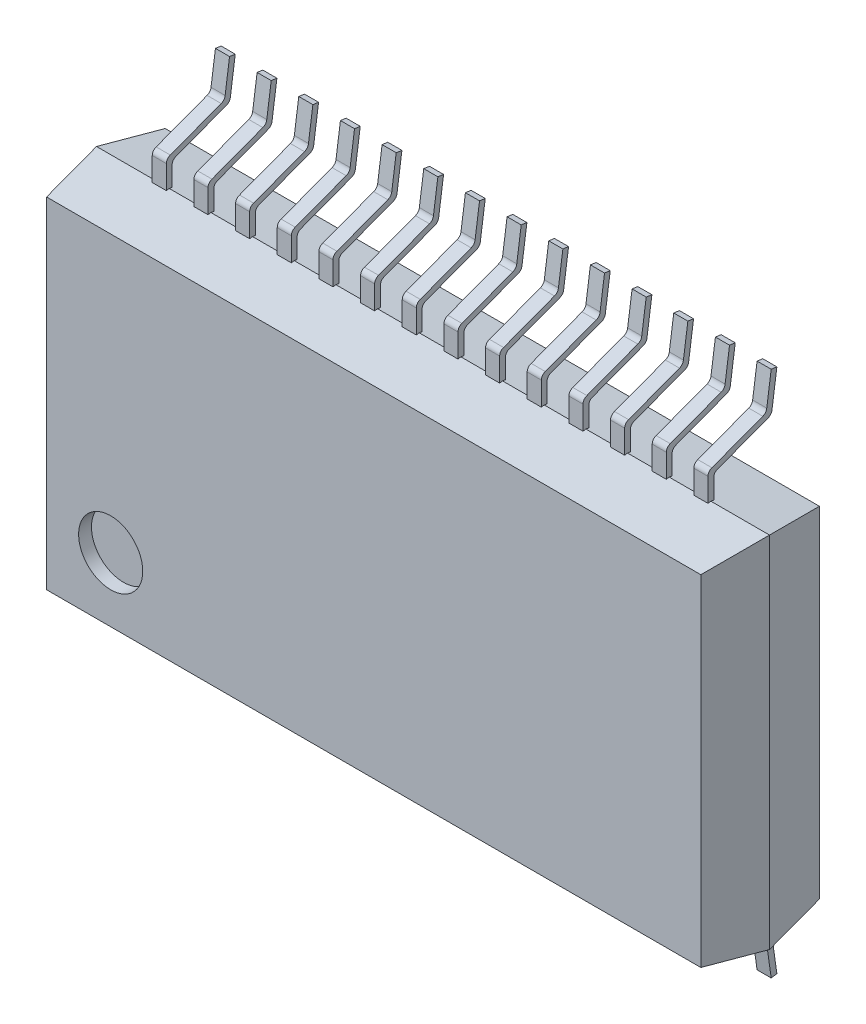
from build123d import *

# Parameters (mm, degrees)
ESBO_O1_W                  = 10.5
ESBO_O1_H                  = 5.6
EXTRUS_O1_DEPTH            = 0.925
EXTRUS_O1_TAPER            = 9
ESBO_O2_W                  = 10.5
ESBO_O2_H                  = 5.6
EXTRUS_O2_DEPTH            = 0.925
EXTRUS_O2_DRAFT            = -9
EXTRUS_O3_DEPTH            = 0.22
EXTRUS_O3_2_DEPTH          = 0.22
PADR_O_LINEAR2_COUNT       = 14
PADR_O_LINEAR2_PITCH       = 0.65
CORTE_EXTRUS_O1_DEPTH      = 0.2
CORTE_EXTRUS_O1_DEPTH_BACK = 0.2
CORTE_EXTRUS_O1_START      = 0.925
ESBO_O7_R                  = 0.5


with BuildPart() as part:
    # Esboço1 → Extrusão1 (new body)
    with BuildSketch(Plane.XY):
        with Locations((4.335, 2.8)):
            Rectangle(ESBO_O1_W, ESBO_O1_H)
    extrude(amount=EXTRUS_O1_DEPTH, taper=EXTRUS_O1_TAPER)

    # Esboço7 → Corte-extrusão1 (cut, two sides: drawn at the far end of the back side and taken through both)
    with BuildSketch(Plane.XY.offset(CORTE_EXTRUS_O1_START - CORTE_EXTRUS_O1_DEPTH_BACK)):
        with Locations((0.231505607, 1.146505607)):
            Circle(ESBO_O7_R)
    extrude(amount=CORTE_EXTRUS_O1_DEPTH + CORTE_EXTRUS_O1_DEPTH_BACK, mode=Mode.SUBTRACT)


with BuildPart() as body_2:
    # Esboço2 → Extrusão2 (with draft: the straight prism first)
    with BuildSketch(Plane.XY):
        with Locations((4.335, 2.8)):
            Rectangle(ESBO_O2_W, ESBO_O2_H)
    extrude(amount=-EXTRUS_O2_DEPTH)
    # Extrusão2: the draft: its side faces are tilted about the plane it starts from
    extrus_o2_sides = [body_2.faces().sort_by_distance(p)[0] for p in [
        (-0.915, 2.8, -0.4625),
        (4.335, 0, -0.4625),
        (9.585, 2.8, -0.4625),
        (4.335, 5.6, -0.4625),
    ]]
    draft(extrus_o2_sides, Plane.XY, EXTRUS_O2_DRAFT)


with BuildPart() as body_3:
    # Esboço3 → Extrusão3 (new body)
    with BuildSketch(Plane(origin=(0, 0, 0), x_dir=(0, 0, -1), z_dir=(1, 0, 0))):
        with BuildLine():
            Line((1.03, 6.9), (0.940875874, 6.912525579))
            Line((0.940875874, 6.912525579), (0.871853672, 6.421407093))
            ThreePointArc((0.871853672, 6.421407093), (0.85269388, 6.372952019), (0.810404985, 6.342511238))
            Line((0.810404985, 6.342511238), (0.016401135, 6.04365025))
            ThreePointArc((0.016401135, 6.04365025), (-0.028486187, 6.011150447), (-0.045, 5.958250515))
            Line((-0.045, 5.958250515), (-0.045, 5.5928727))
            Line((-0.045, 5.5928727), (0, 5.6))
            Line((0, 5.6), (0.045, 5.5928727))
            Line((0.045, 5.5928727), (0.045, 5.895962007))
            ThreePointArc((0.045, 5.895962007), (0.061513813, 5.94886194), (0.106401135, 5.981361743))
            Line((0.106401135, 5.981361743), (0.895282694, 6.278294714))
            ThreePointArc((0.895282694, 6.278294714), (0.933531499, 6.306508852), (0.952702541, 6.35))
            Line((0.952702541, 6.35), (1.03, 6.9))
        make_face()
    extrude(amount=EXTRUS_O3_DEPTH)


with BuildPart() as body_4:
    # Esboço3 → Extrus_o3 2 (new body)
    with BuildSketch(Plane(origin=(0, 0, 0), x_dir=(0, 0, -1), z_dir=(1, 0, 0))):
        with BuildLine():
            Line((0, 0), (0.045, 0.0071273))
            Line((0.045, 0.0071273), (0.045, -0.295962007))
            ThreePointArc((0.045, -0.295962007), (0.061513813, -0.34886194), (0.106401135, -0.381361743))
            Line((0.106401135, -0.381361743), (0.895282694, -0.678294714))
            ThreePointArc((0.895282694, -0.678294714), (0.933531499, -0.706508852), (0.952702541, -0.75))
            Line((0.952702541, -0.75), (1.03, -1.3))
            Line((1.03, -1.3), (0.940875874, -1.312525579))
            Line((0.940875874, -1.312525579), (0.871853672, -0.821407093))
            ThreePointArc((0.871853672, -0.821407093), (0.85269388, -0.772952019), (0.810404985, -0.742511238))
            Line((0.810404985, -0.742511238), (0.016401135, -0.44365025))
            ThreePointArc((0.016401135, -0.44365025), (-0.028486187, -0.411150447), (-0.045, -0.358250515))
            Line((-0.045, -0.358250515), (-0.045, 0.0071273))
            Line((-0.045, 0.0071273), (0, 0))
        make_face()
    extrude(amount=EXTRUS_O3_2_DEPTH)


with BuildPart() as padr_o_linear2_1:
    # Padrão linear2: pattern copy
    add(body_4.part.moved(Location(Vector(1, 0, 0) * (1 * PADR_O_LINEAR2_PITCH))))


with BuildPart() as padr_o_linear2_2:
    # Padrão linear2: pattern copy
    add(body_4.part.moved(Location(Vector(1, 0, 0) * (2 * PADR_O_LINEAR2_PITCH))))


with BuildPart() as padr_o_linear2_3:
    # Padrão linear2: pattern copy
    add(body_4.part.moved(Location(Vector(1, 0, 0) * (3 * PADR_O_LINEAR2_PITCH))))


with BuildPart() as padr_o_linear2_4:
    # Padrão linear2: pattern copy
    add(body_4.part.moved(Location(Vector(1, 0, 0) * (4 * PADR_O_LINEAR2_PITCH))))


with BuildPart() as padr_o_linear2_5:
    # Padrão linear2: pattern copy
    add(body_4.part.moved(Location(Vector(1, 0, 0) * (5 * PADR_O_LINEAR2_PITCH))))


with BuildPart() as padr_o_linear2_6:
    # Padrão linear2: pattern copy
    add(body_4.part.moved(Location(Vector(1, 0, 0) * (6 * PADR_O_LINEAR2_PITCH))))


with BuildPart() as padr_o_linear2_7:
    # Padrão linear2: pattern copy
    add(body_4.part.moved(Location(Vector(1, 0, 0) * (7 * PADR_O_LINEAR2_PITCH))))


with BuildPart() as padr_o_linear2_8:
    # Padrão linear2: pattern copy
    add(body_4.part.moved(Location(Vector(1, 0, 0) * (8 * PADR_O_LINEAR2_PITCH))))


with BuildPart() as padr_o_linear2_9:
    # Padrão linear2: pattern copy
    add(body_4.part.moved(Location(Vector(1, 0, 0) * (9 * PADR_O_LINEAR2_PITCH))))


with BuildPart() as padr_o_linear2_10:
    # Padrão linear2: pattern copy
    add(body_4.part.moved(Location(Vector(1, 0, 0) * (10 * PADR_O_LINEAR2_PITCH))))


with BuildPart() as padr_o_linear2_11:
    # Padrão linear2: pattern copy
    add(body_4.part.moved(Location(Vector(1, 0, 0) * (11 * PADR_O_LINEAR2_PITCH))))


with BuildPart() as padr_o_linear2_12:
    # Padrão linear2: pattern copy
    add(body_4.part.moved(Location(Vector(1, 0, 0) * (12 * PADR_O_LINEAR2_PITCH))))


with BuildPart() as padr_o_linear2_13:
    # Padrão linear2: pattern copy
    add(body_4.part.moved(Location(Vector(1, 0, 0) * (13 * PADR_O_LINEAR2_PITCH))))


with BuildPart() as padr_o_linear2_14:
    # Padrão linear2: pattern copy
    add(body_3.part.moved(Location(Vector(1, 0, 0) * (1 * PADR_O_LINEAR2_PITCH))))


with BuildPart() as padr_o_linear2_15:
    # Padrão linear2: pattern copy
    add(body_3.part.moved(Location(Vector(1, 0, 0) * (2 * PADR_O_LINEAR2_PITCH))))


with BuildPart() as padr_o_linear2_16:
    # Padrão linear2: pattern copy
    add(body_3.part.moved(Location(Vector(1, 0, 0) * (3 * PADR_O_LINEAR2_PITCH))))


with BuildPart() as padr_o_linear2_17:
    # Padrão linear2: pattern copy
    add(body_3.part.moved(Location(Vector(1, 0, 0) * (4 * PADR_O_LINEAR2_PITCH))))


with BuildPart() as padr_o_linear2_18:
    # Padrão linear2: pattern copy
    add(body_3.part.moved(Location(Vector(1, 0, 0) * (5 * PADR_O_LINEAR2_PITCH))))


with BuildPart() as padr_o_linear2_19:
    # Padrão linear2: pattern copy
    add(body_3.part.moved(Location(Vector(1, 0, 0) * (6 * PADR_O_LINEAR2_PITCH))))


with BuildPart() as padr_o_linear2_20:
    # Padrão linear2: pattern copy
    add(body_3.part.moved(Location(Vector(1, 0, 0) * (7 * PADR_O_LINEAR2_PITCH))))


with BuildPart() as padr_o_linear2_21:
    # Padrão linear2: pattern copy
    add(body_3.part.moved(Location(Vector(1, 0, 0) * (8 * PADR_O_LINEAR2_PITCH))))


with BuildPart() as padr_o_linear2_22:
    # Padrão linear2: pattern copy
    add(body_3.part.moved(Location(Vector(1, 0, 0) * (9 * PADR_O_LINEAR2_PITCH))))


with BuildPart() as padr_o_linear2_23:
    # Padrão linear2: pattern copy
    add(body_3.part.moved(Location(Vector(1, 0, 0) * (10 * PADR_O_LINEAR2_PITCH))))


with BuildPart() as padr_o_linear2_24:
    # Padrão linear2: pattern copy
    add(body_3.part.moved(Location(Vector(1, 0, 0) * (11 * PADR_O_LINEAR2_PITCH))))


with BuildPart() as padr_o_linear2_25:
    # Padrão linear2: pattern copy
    add(body_3.part.moved(Location(Vector(1, 0, 0) * (12 * PADR_O_LINEAR2_PITCH))))


with BuildPart() as padr_o_linear2_26:
    # Padrão linear2: pattern copy
    add(body_3.part.moved(Location(Vector(1, 0, 0) * (13 * PADR_O_LINEAR2_PITCH))))


solid = Compound([part.part, body_2.part, body_3.part, body_4.part, padr_o_linear2_1.part, padr_o_linear2_2.part, padr_o_linear2_3.part, padr_o_linear2_4.part, padr_o_linear2_5.part, padr_o_linear2_6.part, padr_o_linear2_7.part, padr_o_linear2_8.part, padr_o_linear2_9.part, padr_o_linear2_10.part, padr_o_linear2_11.part, padr_o_linear2_12.part, padr_o_linear2_13.part, padr_o_linear2_14.part, padr_o_linear2_15.part, padr_o_linear2_16.part, padr_o_linear2_17.part, padr_o_linear2_18.part, padr_o_linear2_19.part, padr_o_linear2_20.part, padr_o_linear2_21.part, padr_o_linear2_22.part, padr_o_linear2_23.part, padr_o_linear2_24.part, padr_o_linear2_25.part, padr_o_linear2_26.part])
